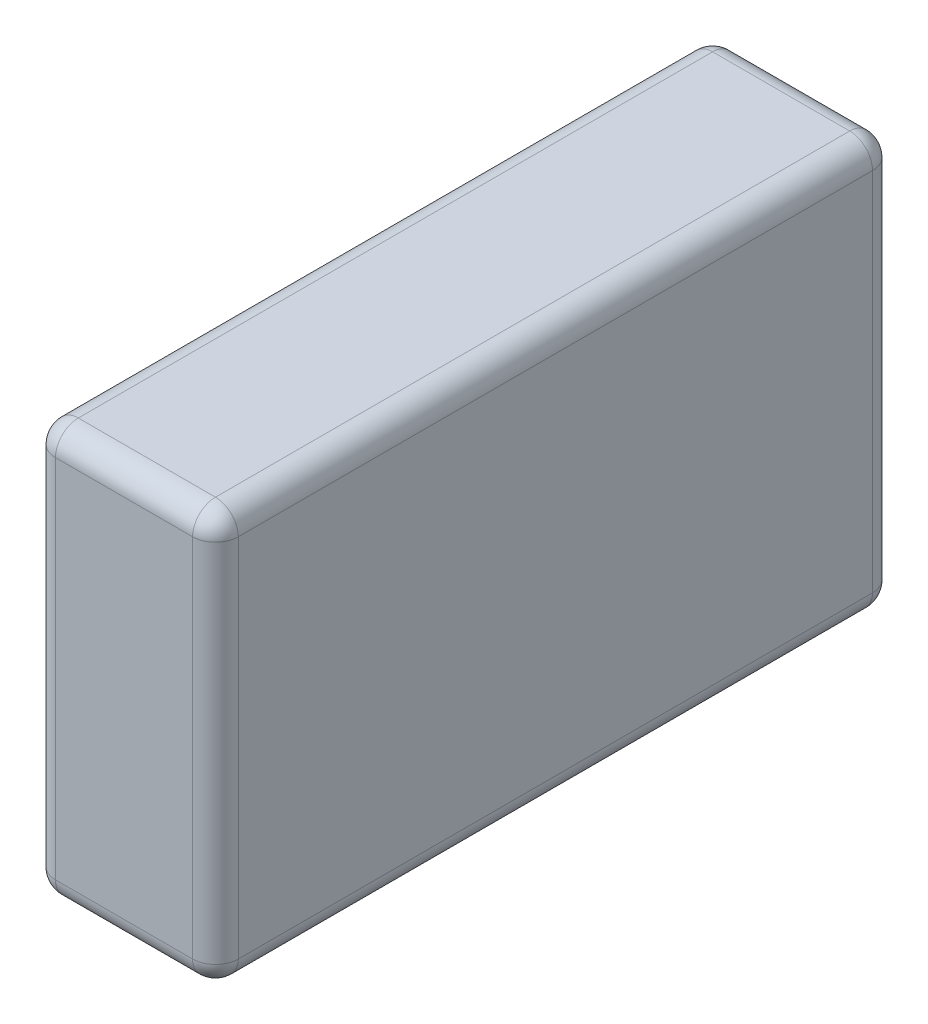
from build123d import *

# Parameters (mm, degrees)
SKETCH_1_W      = 119
SKETCH_1_H      = 72
EXTRUDE_1_DEPTH = 32
FILLET_1_R      = 4


with BuildPart() as part:
    # 草图1 → 凸台-拉伸1 (new body)
    with BuildSketch(Plane(origin=(0, 0, 0), x_dir=(0, 0, -1), z_dir=(1, 0, 0))):
        with Locations((0.5, 0)):
            Rectangle(SKETCH_1_W, SKETCH_1_H)
    extrude(amount=EXTRUDE_1_DEPTH)

    # 圆角1
    fillet_1_edges = [part.edges().sort_by_distance(p)[0] for p in [
        (32, 0, -60),
        (32, 36, -0.5),
        (32, 0, 59),
        (0, 36, -0.5),
        (0, 0, -60),
        (0, -36, -0.5),
        (0, 0, 59),
        (16, 36, 59),
        (16, 36, -60),
        (16, -36, -60),
        (16, -36, 59),
        (32, -36, -0.5),
    ]]
    fillet(fillet_1_edges, radius=FILLET_1_R)


solid = part.part
